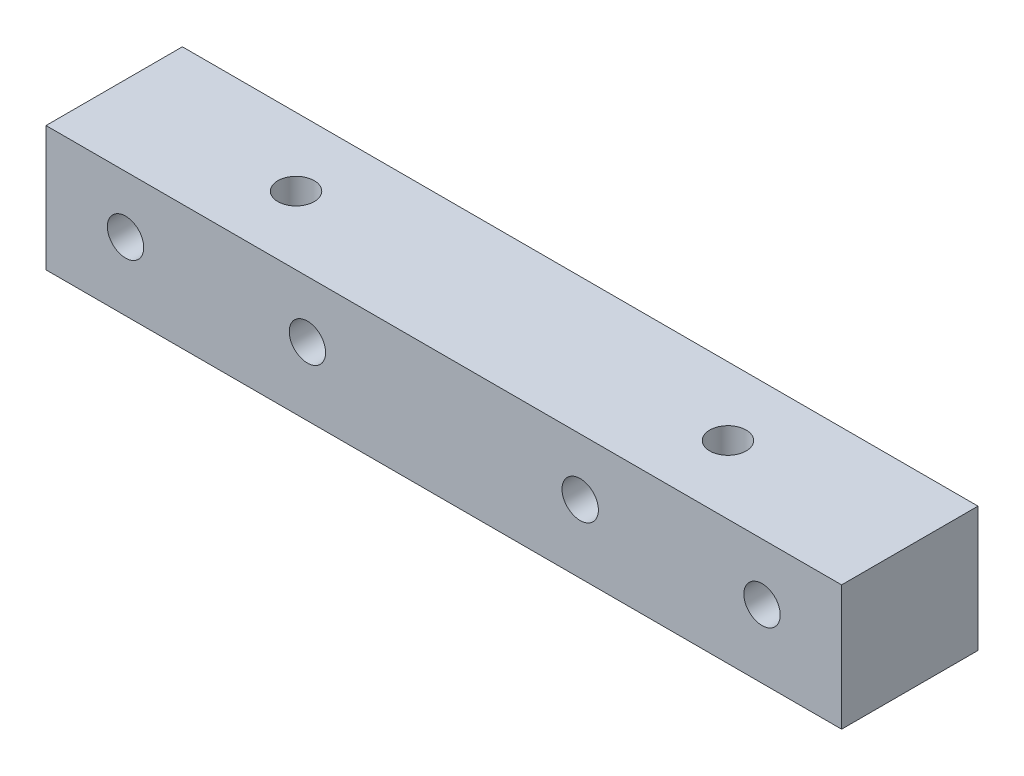
from build123d import *

# Parameters (mm, degrees)
SKETCH1_W             = 35
SKETCH1_H             = 6
BOSS_EXTRUDE1_DEPTH   = 5.5
M2X0_4_TAPPED_HOLE1_D = 1.6
M2X0_4_TAPPED_HOLE2_D = 1.6


with BuildPart() as part:
    # Sketch1 → Boss-Extrude1 (new body)
    with BuildSketch(Plane(origin=(0, 0, 0), x_dir=(1, 0, 0), z_dir=(0, 1, 0))):
        Rectangle(SKETCH1_W, SKETCH1_H)
    extrude(amount=BOSS_EXTRUDE1_DEPTH)

    # M2x0.4 Tapped Hole1 (through all)
    with Locations(Plane.XY.offset(3)):
        with Locations((6, 3), (-14, 3), (-6, 3), (14, 3)):
            Hole(M2X0_4_TAPPED_HOLE1_D / 2)

    # M2x0.4 Tapped Hole2 (through all)
    with Locations(Plane(origin=(0, 5.5, 0), x_dir=(-1, 0, 0), z_dir=(0, 1, 0))):
        with Locations((9.5, 0), (-9.5, 0)):
            Hole(M2X0_4_TAPPED_HOLE2_D / 2)


solid = part.part
